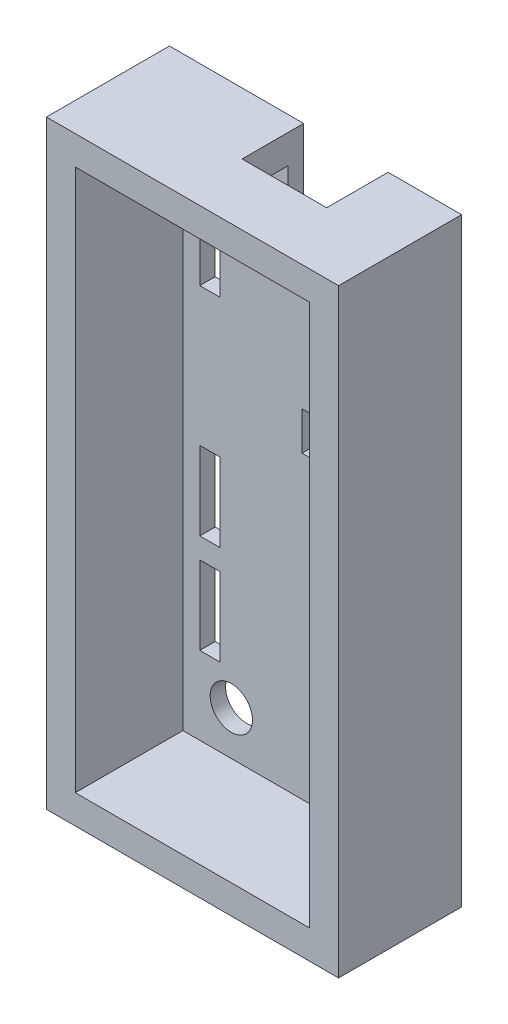
from build123d import *

# Parameters (mm, degrees)
SKETCH1_W           = 38
SKETCH1_H           = 78
BOSS_EXTRUDE1_DEPTH = 16
SKETCH2_W           = 30.5
SKETCH2_H           = 70.5
CUT_EXTRUDE1_DEPTH  = 14
SKETCH3_R           = 2.75
SKETCH3_W           = 2.6
SKETCH3_H           = 5.12
SKETCH3_H_2         = 7.65
SKETCH3_H_3         = 10.2
SKETCH3_W_2         = 11
SKETCH3_H_4         = 12.5
SKETCH3_W_3         = 10.5
SKETCH3_H_5         = 14.5
SKETCH3_W_4         = 7
SKETCH3_H_6         = 5
CUT_EXTRUDE2_DEPTH  = 88.886290171
SKETCH4_W           = 11
SKETCH4_H           = 8
CUT_EXTRUDE3_DEPTH  = 3.75


with BuildPart() as part:
    # Sketch1 → Boss-Extrude1 (new body)
    with BuildSketch(Plane.XY):
        with Locations((19, 39)):
            Rectangle(SKETCH1_W, SKETCH1_H)
    extrude(amount=BOSS_EXTRUDE1_DEPTH)

    # Sketch2 → Cut-Extrude1 (cut)
    with BuildSketch(Plane.XY.offset(16)):
        with Locations((19, 39)):
            Rectangle(SKETCH2_W, SKETCH2_H)
    extrude(amount=-CUT_EXTRUDE1_DEPTH, mode=Mode.SUBTRACT)

    # Sketch3 → Cut-Extrude2 (cut, through all)
    with BuildSketch(Plane.XY.offset(2)):
        with Locations((10.05, 9.45)):
            Circle(SKETCH3_R)
        with Locations((7.25, 67.19)):
            Rectangle(SKETCH3_W, SKETCH3_H)
        with Locations((7.25, 58.805)):
            Rectangle(SKETCH3_W, SKETCH3_H_2)
        with Locations((7.25, 31.88)):
            Rectangle(SKETCH3_W, SKETCH3_H_3)
        with Locations((7.25, 18.98)):
            Rectangle(SKETCH3_W, SKETCH3_H_3)
        with Locations((22.95, 68)):
            Rectangle(SKETCH3_W_2, SKETCH3_H_4)
        with Locations((25.5, 21.5)):
            Rectangle(SKETCH3_W_3, SKETCH3_H_5)
        with Locations((22.75, 45.25)):
            Rectangle(SKETCH3_W_4, SKETCH3_H_6)
    extrude(amount=-CUT_EXTRUDE2_DEPTH, mode=Mode.SUBTRACT)

    # Sketch4 → Cut-Extrude3 (cut)
    with BuildSketch(Plane(origin=(0, 78, 0), x_dir=(1, 0, 0), z_dir=(0, 1, 0))):
        with Locations((22.95, -4)):
            Rectangle(SKETCH4_W, SKETCH4_H)
    extrude(amount=-CUT_EXTRUDE3_DEPTH, mode=Mode.SUBTRACT)


solid = part.part
